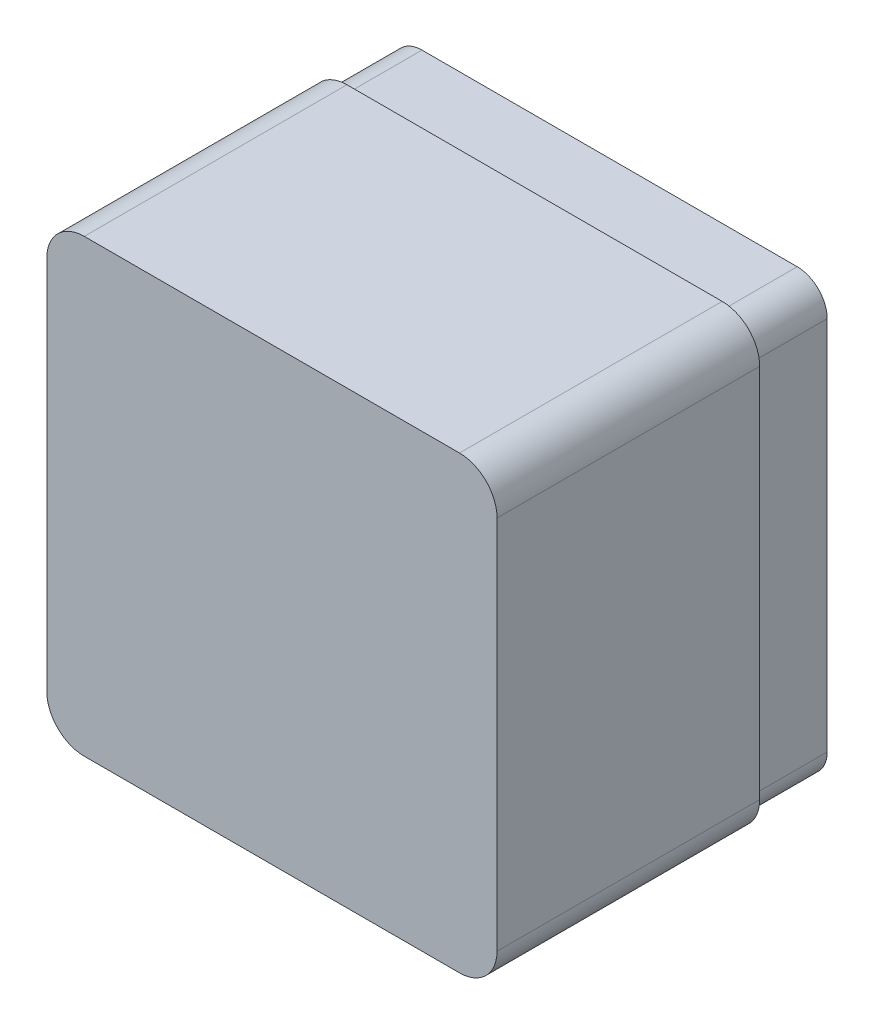
from build123d import *

# Parameters (mm, degrees)
SKETCH1_W           = 120
SKETCH1_H           = 120
BOSS_EXTRUDE1_DEPTH = 90
FILLET1_R           = 10
SHELL1_T            = -4
CUT_EXTRUDE1_START  = -20
CUT_EXTRUDE1_DEPTH  = 20


with BuildPart() as part:
    # Sketch1 → Boss-Extrude1 (new body)
    with BuildSketch(Plane.XY):
        Rectangle(SKETCH1_W, SKETCH1_H)
    extrude(amount=BOSS_EXTRUDE1_DEPTH)

    # Fillet1
    fillet1_edges = [part.edges().sort_by_distance(p)[0] for p in [
        (-60, 60, 45),
        (60, 60, 45),
        (60, -60, 45),
        (-60, -60, 45),
    ]]
    fillet(fillet1_edges, radius=FILLET1_R)

    # Shell1
    shell1_openings = [part.faces().sort_by_distance(p)[0] for p in [
        (0, 0, 0),
    ]]
    offset(amount=SHELL1_T, openings=shell1_openings, kind=Kind.INTERSECTION)

    # Sketch3 → Cut-Extrude1 (cut)
    with BuildSketch(Plane(origin=(0, 0, 0), x_dir=(-1, 0, 0), z_dir=(0, 0, -1)).offset(CUT_EXTRUDE1_START)):
        with BuildLine():
            Line((-50, -60), (50, -60))
            ThreePointArc((50, -60), (57.071067812, -57.071067812), (60, -50))
            Line((60, -50), (60, 50))
            ThreePointArc((60, 50), (57.071067812, 57.071067812), (50, 60))
            Line((50, 60), (-50, 60))
            ThreePointArc((-50, 60), (-57.071067812, 57.071067812), (-60, 50))
            Line((-60, 50), (-60, -50))
            ThreePointArc((-60, -50), (-57.071067812, -57.071067812), (-50, -60))
        make_face()
        with BuildLine():
            Line((50, 58), (-50, 58))
            ThreePointArc((-50, 58), (-55.656854249, 55.656854249), (-58, 50))
            Line((-58, 50), (-58, -50))
            ThreePointArc((-58, -50), (-55.656854249, -55.656854249), (-50, -58))
            Line((-50, -58), (50, -58))
            ThreePointArc((50, -58), (55.656854249, -55.656854249), (58, -50))
            Line((58, -50), (58, 50))
            ThreePointArc((58, 50), (55.656854249, 55.656854249), (50, 58))
        make_face(mode=Mode.SUBTRACT)
    extrude(amount=CUT_EXTRUDE1_DEPTH, mode=Mode.SUBTRACT)


solid = part.part
